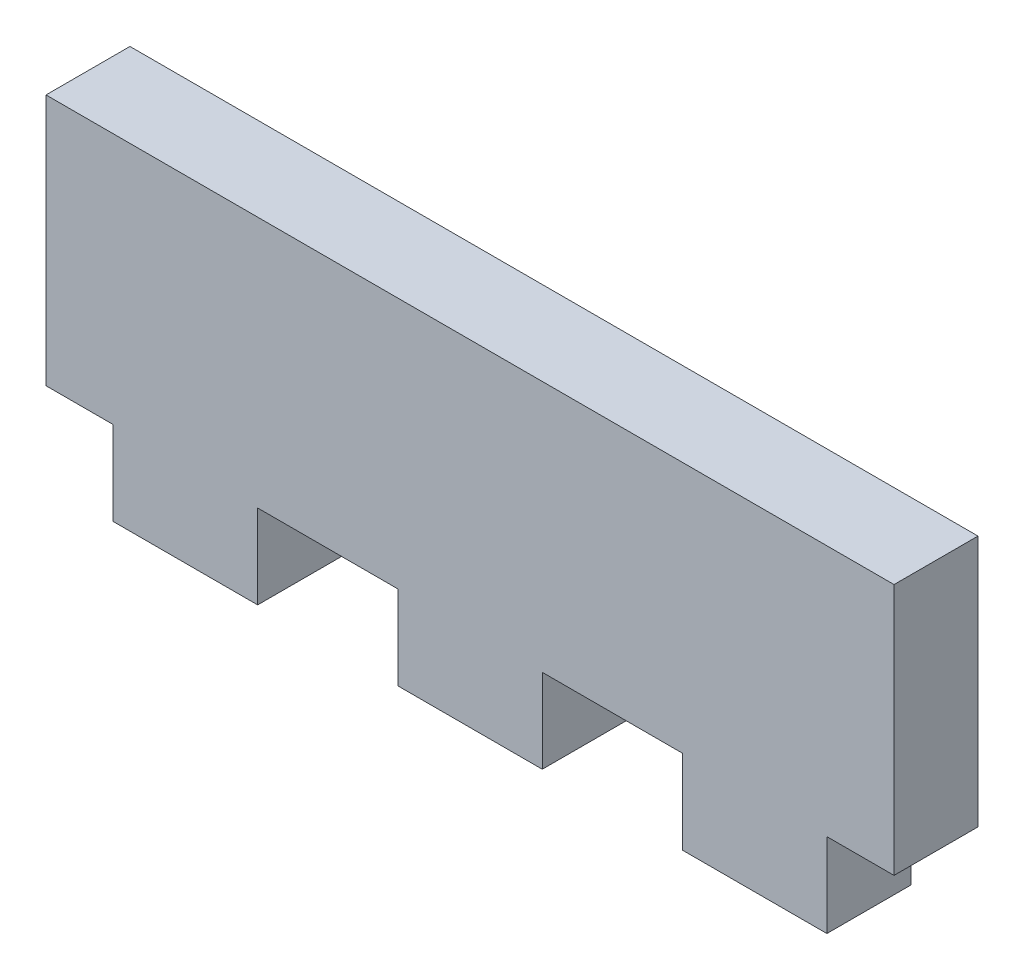
from build123d import *

# Parameters (mm, degrees)
BOSS_EXTRUDE1_DEPTH = 5


with BuildPart() as part:
    # Sketch1 → Boss-Extrude1 (new body)
    with BuildSketch(Plane.XY):
        Polygon((-5.696477884, 26.539959489), (-14.297177884, 26.539959489), (-14.297177884, 31.539959489), (-22.643977884, 31.539959489), (-22.643977884, 26.539959489), (-31.248177884, 26.539959489), (-31.248177884, 31.539959489), (-39.594877884, 31.539959489), (-39.594877884, 26.539959489), (-48.199177884, 26.539959489), (-48.199177884, 31.539959489), (-52.199177884, 31.539959489), (-52.199177884, 46.539959489), (-1.696477884, 46.539959489), (-1.696477884, 31.539959489), (-5.696477884, 31.539959489), align=None)
    extrude(amount=BOSS_EXTRUDE1_DEPTH)


solid = part.part
